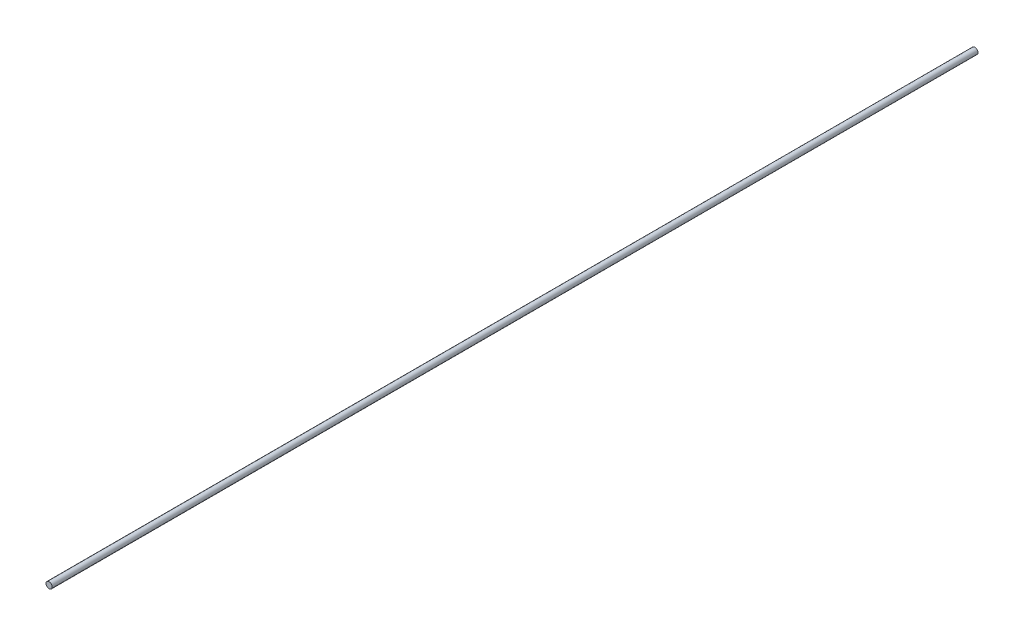
from build123d import *

# Parameters (mm, degrees)
SKETCH1_R           = 0.5
BOSS_EXTRUDE1_DEPTH = 150


with BuildPart() as part:
    # Sketch1 → Boss-Extrude1 (new body)
    with BuildSketch(Plane.XY):
        Circle(SKETCH1_R)
    extrude(amount=BOSS_EXTRUDE1_DEPTH)


solid = part.part
